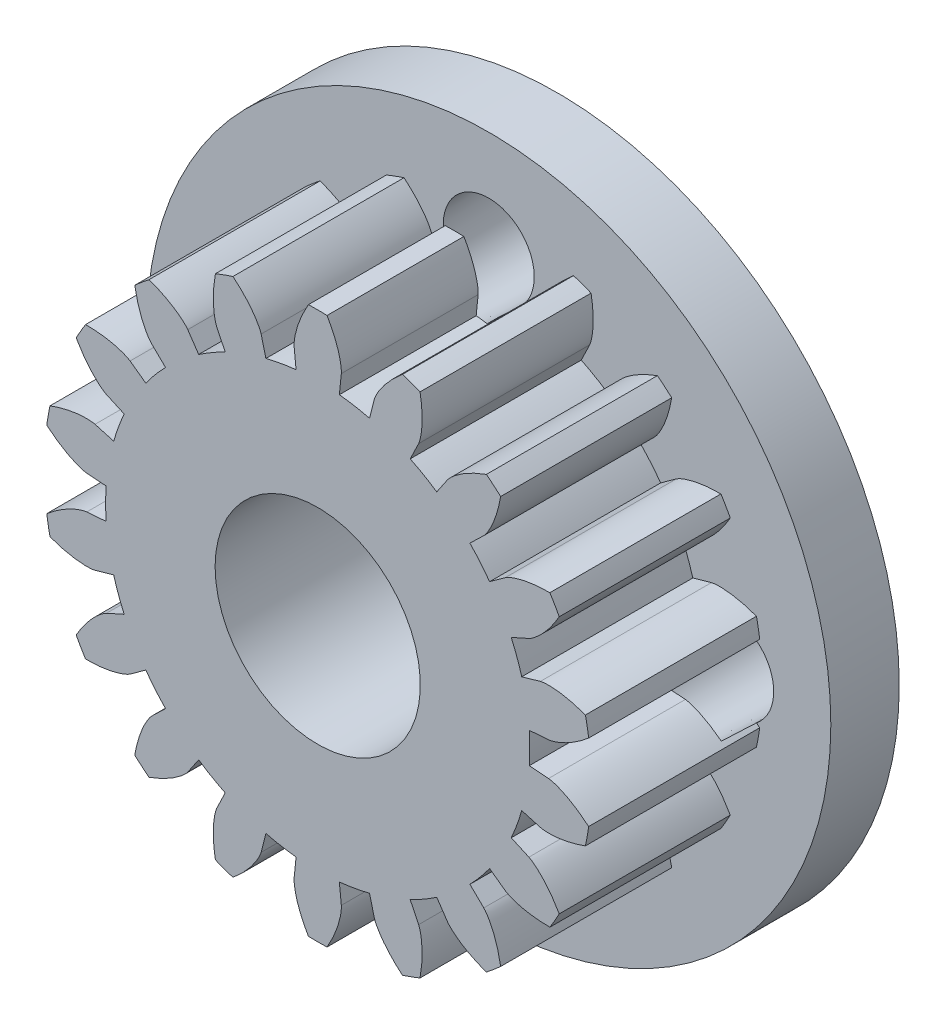
from build123d import *

# Parameters (mm, degrees)
SKETCH1_R                    = 10
BOSS_EXTRUDE1_DEPTH          = 2
BOSS_EXTRUDE3_DEPTH          = 5
SKETCH3_R                    = 3
CUT_EXTRUDE1_DEPTH           = 16.779734009
SKETCH4_R                    = 1.4
CUT_EXTRUDE2_DEPTH           = 3
CUT_EXTRUDE2_DRAFT           = -2
CUT_EXTRUDE2_PROFILE_2_DEPTH = 3
CUT_EXTRUDE2_PROFILE_2_DRAFT = -2
CUT_EXTRUDE2_PROFILE_3_DEPTH = 3
CUT_EXTRUDE2_PROFILE_3_DRAFT = -2
CUT_EXTRUDE2_PROFILE_4_DEPTH = 3
CUT_EXTRUDE2_PROFILE_4_DRAFT = -2


with BuildPart() as part:
    # Sketch1 → Boss-Extrude1 (new body)
    with BuildSketch(Plane.XY):
        Circle(SKETCH1_R)
    extrude(amount=BOSS_EXTRUDE1_DEPTH)

    # Sketch2 → Boss-Extrude3 (add)
    with BuildSketch(Plane.XY.offset(2)):
        with BuildLine():
            Line((6.749014782, 0.489400994), (6.183763142, 0.448412091))
            ThreePointArc((6.183763142, 0.448412091), (6.2, 2.2466e-05), (6.183766392, -0.448367277))
            Line((6.183766392, -0.448367277), (6.7483, -0.4893))
            add(Edge.make_bspline(
                [(6.7483, -0.4893), (6.753863752, -0.489778126), (6.764345101, -0.491112246), (6.781397959, -0.493753519), (6.814897771, -0.500152162), (6.852529813, -0.509001834), (6.894773821, -0.520587391), (6.939887939, -0.53462383), (6.978268806, -0.547605925), (7.016365203, -0.561466191), (7.054135561, -0.576092056), (7.09966227, -0.594772535), (7.153931561, -0.618509956), (7.21686143, -0.648193147), (7.287614248, -0.684137055), (7.35901509, -0.723188438), (7.428676186, -0.763596878), (7.498328383, -0.806683063), (7.565199484, -0.849970773), (7.633856787, -0.897221753), (7.696826935, -0.94200301), (7.766440753, -0.994680614), (7.822350549, -1.037926185), (7.879293096, -1.084670342), (7.906886064, -1.107725747), (7.920936065, -1.119636494)],
                knots=[0, 0, 0, 0, 0, 0.015083688, 0.02853182, 0.04661014, 0.092110526, 0.119476176, 0.146842496, 0.174208854, 0.201574956, 0.228941013, 0.256307345, 0.307035032, 0.361767352, 0.416499661, 0.471231937, 0.525964282, 0.580696616, 0.635428982, 0.690161387, 0.744893688, 0.799626082, 0.854358407, 0.909090915, 0.909090915, 0.909090915, 0.909090915, 0.909090915], degree=4))
            ThreePointArc((7.920936065, -1.119636494), (7.878103284, -1.389353333), (7.826089081, -1.657450971))
            add(Edge.make_bspline(
                [(6.509384386, -1.8484125), (6.514772707, -1.849865225), (6.525071673, -1.852195094), (6.541988666, -1.855543841), (6.575635107, -1.860986482), (6.613999847, -1.865540467), (6.657630816, -1.86910235), (6.704794877, -1.871344356), (6.745275474, -1.872274877), (6.785789161, -1.872283771), (6.826258429, -1.871462512), (6.875397666, -1.869485851), (6.934475711, -1.865749904), (7.003719504, -1.859392237), (7.082450192, -1.849830902), (7.162852052, -1.837573828), (7.242084325, -1.82344817), (7.322224026, -1.806805657), (7.399821168, -1.789023424), (7.480451083, -1.768131029), (7.554896071, -1.747613381), (7.638280252, -1.721953453), (7.705570428, -1.700464331), (7.775027063, -1.676043734), (7.808822361, -1.663830526), (7.826089081, -1.657450971)],
                knots=[0, 0, 0, 0, 0, 0.015083688, 0.02853182, 0.04661014, 0.092110526, 0.119476176, 0.146842496, 0.174208854, 0.201574956, 0.228941013, 0.256307345, 0.307035032, 0.361767352, 0.416499661, 0.471231937, 0.525964282, 0.580696616, 0.635428982, 0.690161387, 0.744893688, 0.799626082, 0.854358407, 0.909090915, 0.909090915, 0.909090915, 0.909090915, 0.909090915], degree=4))
            Line((6.509384386, -1.8484125), (5.964202561, -1.693602023))
            ThreePointArc((5.964202561, -1.693602023), (5.826101933, -2.120503778), (5.657489006, -2.536300089))
            Line((5.657489006, -2.536300089), (6.173977257, -2.767846133))
            add(Edge.make_bspline(
                [(6.173977257, -2.767846133), (6.179041945, -2.770198339), (6.188434895, -2.775036834), (6.203555971, -2.78335124), (6.232847033, -2.800821609), (6.265182819, -2.822008496), (6.300916708, -2.847343661), (6.338509366, -2.875963536), (6.370135446, -2.901289744), (6.401193859, -2.927343868), (6.431684045, -2.954005909), (6.468076057, -2.98713087), (6.510953833, -3.027997939), (6.559936318, -3.077414298), (6.614128678, -3.135389411), (6.667867163, -3.196506234), (6.719506681, -3.258303245), (6.770221993, -3.322613469), (6.818255004, -3.386161875), (6.866610979, -3.454045453), (6.91046747, -3.517663128), (6.957866259, -3.590973213), (6.995613425, -3.650733033), (7.033134474, -3.71413367), (7.051177969, -3.745236016), (7.060306936, -3.76123384)],
                knots=[0, 0, 0, 0, 0, 0.015083688, 0.02853182, 0.04661014, 0.092110526, 0.119476176, 0.146842496, 0.174208854, 0.201574956, 0.228941013, 0.256307345, 0.307035032, 0.361767352, 0.416499661, 0.471231937, 0.525964282, 0.580696616, 0.635428982, 0.690161387, 0.744893688, 0.799626082, 0.854358407, 0.909090915, 0.909090915, 0.909090915, 0.909090915, 0.909090915], degree=4))
            ThreePointArc((7.060306936, -3.76123384), (6.927808695, -4.000035089), (6.787236541, -4.234174556))
            add(Edge.make_bspline(
                [(5.484626165, -3.963280168), (5.48919267, -3.966488197), (5.498073669, -3.97220001), (5.512825104, -3.981132756), (5.542580924, -3.997754927), (5.577074432, -4.015155787), (5.616855897, -4.033425532), (5.660408805, -4.051663387), (5.698129866, -4.06638297), (5.736197238, -4.080247825), (5.774506797, -4.093317399), (5.821358633, -4.108266554), (5.878151605, -4.124961794), (5.945393936, -4.142670313), (6.022646753, -4.160613078), (6.102391953, -4.176594252), (6.181677195, -4.190419509), (6.262675955, -4.202190054), (6.341675298, -4.212020006), (6.424588255, -4.219964632), (6.501561109, -4.226146035), (6.588692821, -4.230552659), (6.659274616, -4.233374086), (6.732894839, -4.2341818), (6.768829195, -4.23426381), (6.787236541, -4.234174556)],
                knots=[0, 0, 0, 0, 0, 0.015083688, 0.02853182, 0.04661014, 0.092110526, 0.119476176, 0.146842496, 0.174208854, 0.201574956, 0.228941013, 0.256307345, 0.307035032, 0.361767352, 0.416499661, 0.471231937, 0.525964282, 0.580696616, 0.635428982, 0.690161387, 0.744893688, 0.799626082, 0.854358407, 0.909090915, 0.909090915, 0.909090915, 0.909090915, 0.909090915], degree=4))
            Line((5.484626165, -3.963280168), (5.025271128, -3.631342739))
            ThreePointArc((5.025271128, -3.631342739), (4.749489988, -3.98526597), (4.448834952, -4.318317679))
            Line((4.448834952, -4.318317679), (4.854981738, -4.712549172))
            add(Edge.make_bspline(
                [(4.854981738, -4.712549172), (4.858936486, -4.716491749), (4.866108109, -4.724251025), (4.877473578, -4.737235724), (4.899022955, -4.763670633), (4.922162312, -4.794639285), (4.947076048, -4.830668262), (4.972613017, -4.870419594), (4.993669738, -4.905035202), (5.013944064, -4.940140673), (5.033476512, -4.975623054), (5.056344414, -5.019197136), (5.082658982, -5.072264683), (5.111786071, -5.135453867), (5.142881576, -5.208467532), (5.172476049, -5.284278204), (5.1998655, -5.360010154), (5.225526913, -5.437787655), (5.248928344, -5.51393188), (5.271150546, -5.594260295), (5.29060364, -5.669041158), (5.310070407, -5.754141445), (5.325102078, -5.823207598), (5.338676036, -5.895617663), (5.344993747, -5.931015546), (5.348100592, -5.949170874)],
                knots=[0, 0, 0, 0, 0, 0.015083688, 0.02853182, 0.04661014, 0.092110526, 0.119476176, 0.146842496, 0.174208854, 0.201574956, 0.228941013, 0.256307345, 0.307035032, 0.361767352, 0.416499661, 0.471231937, 0.525964282, 0.580696616, 0.635428982, 0.690161387, 0.744893688, 0.799626082, 0.854358407, 0.909090915, 0.909090915, 0.909090915, 0.909090915, 0.909090915], degree=4))
            ThreePointArc((5.348100592, -5.949170874), (5.141918135, -6.128253579), (4.929743104, -6.3001942))
            add(Edge.make_bspline(
                [(3.798341085, -5.600117755), (3.801534984, -5.604694153), (3.807926839, -5.613098983), (3.818733474, -5.626538306), (3.841009681, -5.652335126), (3.867471532, -5.680484061), (3.89860526, -5.711258067), (3.933293892, -5.743292018), (3.963705701, -5.770025264), (3.99473527, -5.796073774), (4.026264423, -5.821457797), (4.065177835, -5.851529679), (4.112835663, -5.886642413), (4.169966116, -5.92628121), (4.23642323, -5.969563913), (4.305893323, -6.011855769), (4.375668563, -6.051964411), (4.447756737, -6.090728313), (4.518629795, -6.126984813), (4.593825267, -6.16280822), (4.664041925, -6.194943106), (4.744411798, -6.228884779), (4.809772005, -6.255676448), (4.878676131, -6.28161505), (4.91241533, -6.293982388), (4.929743104, -6.3001942)],
                knots=[0, 0, 0, 0, 0, 0.015083688, 0.02853182, 0.04661014, 0.092110526, 0.119476176, 0.146842496, 0.174208854, 0.201574956, 0.228941013, 0.256307345, 0.307035032, 0.361767352, 0.416499661, 0.471231937, 0.525964282, 0.580696616, 0.635428982, 0.690161387, 0.744893688, 0.799626082, 0.854358407, 0.909090915, 0.909090915, 0.909090915, 0.909090915, 0.909090915], degree=4))
            Line((3.798341085, -5.600117755), (3.480217833, -5.131089927))
            ThreePointArc((3.480217833, -5.131089927), (3.100019456, -5.369346271), (2.703585744, -5.579482425))
            Line((2.703585744, -5.579482425), (2.95040377, -6.088849232))
            add(Edge.make_bspline(
                [(2.95040377, -6.088849232), (2.952771577, -6.093906646), (2.95685687, -6.10365082), (2.963095889, -6.119739665), (2.974304407, -6.151950675), (2.985456387, -6.188965815), (2.996545005, -6.231342978), (3.006946151, -6.27743117), (3.014893761, -6.317161023), (3.021938617, -6.357083603), (3.028157425, -6.397106625), (3.03474301, -6.445874152), (3.041320446, -6.504741447), (3.047078983, -6.574081908), (3.051327055, -6.653327599), (3.053207986, -6.734688234), (3.053043799, -6.815220733), (3.050556167, -6.897084397), (3.04650346, -6.976640324), (3.039911563, -7.059724783), (3.032614931, -7.136649159), (3.021801696, -7.223275296), (3.012304831, -7.293317385), (3.000294477, -7.366003156), (2.994124394, -7.40142707), (2.990834386, -7.419550101)],
                knots=[0, 0, 0, 0, 0, 0.015083688, 0.02853182, 0.04661014, 0.092110526, 0.119476176, 0.146842496, 0.174208854, 0.201574956, 0.228941013, 0.256307345, 0.307035032, 0.361767352, 0.416499661, 0.471231937, 0.525964282, 0.580696616, 0.635428982, 0.690161387, 0.744893688, 0.799626082, 0.854358407, 0.909090915, 0.909090915, 0.909090915, 0.909090915, 0.909090915], degree=4))
            ThreePointArc((2.990834386, -7.419550101), (2.73583636, -7.517314244), (2.477649894, -7.606317442))
            add(Edge.make_bspline(
                [(1.653920011, -6.561498492), (1.655356075, -6.566891277), (1.658487832, -6.576975377), (1.664046229, -6.593300296), (1.676155984, -6.62516029), (1.691394487, -6.660662122), (1.710125291, -6.700228591), (1.731765687, -6.742194869), (1.751200131, -6.777717354), (1.771449272, -6.812807684), (1.792395137, -6.847444469), (1.818676594, -6.889011965), (1.851451041, -6.93830708), (1.891578839, -6.99509513), (1.939224542, -7.058497239), (1.99004041, -7.121998755), (2.041889725, -7.183553087), (2.096372414, -7.244634847), (2.15057085, -7.302944827), (2.208979153, -7.362326184), (2.263970451, -7.416538611), (2.327884692, -7.475921465), (2.380139905, -7.523451907), (2.43601708, -7.571392819), (2.463491678, -7.594553801), (2.477649894, -7.606317442)],
                knots=[0, 0, 0, 0, 0, 0.015083688, 0.02853182, 0.04661014, 0.092110526, 0.119476176, 0.146842496, 0.174208854, 0.201574956, 0.228941013, 0.256307345, 0.307035032, 0.361767352, 0.416499661, 0.471231937, 0.525964282, 0.580696616, 0.635428982, 0.690161387, 0.744893688, 0.799626082, 0.854358407, 0.909090915, 0.909090915, 0.909090915, 0.909090915, 0.909090915], degree=4))
            Line((1.653920011, -6.561498492), (1.515398904, -6.011951943))
            ThreePointArc((1.515398904, -6.011951943), (1.076640826, -6.105804168), (0.632244194, -6.167679246))
            Line((0.632244194, -6.167679246), (0.689963564, -6.730744213))
            add(Edge.make_bspline(
                [(0.689963564, -6.730744213), (0.690458837, -6.736306465), (0.690965053, -6.746860246), (0.691325104, -6.764112685), (0.690840852, -6.798214673), (0.688660362, -6.836811729), (0.68458641, -6.880425766), (0.678597201, -6.927291901), (0.672477101, -6.967343994), (0.665442774, -7.00726843), (0.657597862, -7.047004727), (0.647106811, -7.095083614), (0.633153778, -7.152650392), (0.614849199, -7.219778647), (0.591737458, -7.295698165), (0.565677979, -7.37279547), (0.537979957, -7.448415109), (0.507643325, -7.52449097), (0.476625297, -7.59786298), (0.442014381, -7.673682272), (0.408848104, -7.743471945), (0.369059103, -7.821175543), (0.336179164, -7.883745458), (0.300033125, -7.947939958), (0.282119452, -7.979117256), (0.272829414, -7.995022085)],
                knots=[0, 0, 0, 0, 0, 0.015083688, 0.02853182, 0.04661014, 0.092110526, 0.119476176, 0.146842496, 0.174208854, 0.201574956, 0.228941013, 0.256307345, 0.307035032, 0.361767352, 0.416499661, 0.471231937, 0.525964282, 0.580696616, 0.635428982, 0.690161387, 0.744893688, 0.799626082, 0.854358407, 0.909090915, 0.909090915, 0.909090915, 0.909090915, 0.909090915], degree=4))
            ThreePointArc((0.272829414, -7.995022085), (-0.000227656, -7.999675867), (-0.27328446, -7.995006544))
            add(Edge.make_bspline(
                [(-0.689988225, -6.731465673), (-0.690483207, -6.737024396), (-0.690989283, -6.747571475), (-0.691349551, -6.764812965), (-0.690866863, -6.798893346), (-0.688689695, -6.837466031), (-0.684621026, -6.881052662), (-0.678639019, -6.927889514), (-0.67252602, -6.967916703), (-0.665499652, -7.007816441), (-0.657663455, -7.04752828), (-0.647183884, -7.095577738), (-0.633245901, -7.153109514), (-0.614960762, -7.220197341), (-0.591873245, -7.296071625), (-0.565840747, -7.373123581), (-0.53817115, -7.448699243), (-0.507865361, -7.5247315), (-0.476878678, -7.598061914), (-0.442302447, -7.673838954), (-0.409169272, -7.743590102), (-0.369419664, -7.82125169), (-0.336572194, -7.883788031), (-0.300461583, -7.947948872), (-0.282565429, -7.979109942), (-0.27328446, -7.995006544)],
                knots=[0, 0, 0, 0, 0, 0.015083688, 0.02853182, 0.04661014, 0.092110526, 0.119476176, 0.146842496, 0.174208854, 0.201574956, 0.228941013, 0.256307345, 0.307035032, 0.361767352, 0.416499661, 0.471231937, 0.525964282, 0.580696616, 0.635428982, 0.690161387, 0.744893688, 0.799626082, 0.854358407, 0.909090915, 0.909090915, 0.909090915, 0.909090915, 0.909090915], degree=4))
            Line((-0.689988225, -6.731465673), (-0.632199497, -6.167683827))
            ThreePointArc((-0.632199497, -6.167683827), (-1.076596577, -6.10581197), (-1.515355336, -6.011962925))
            Line((-1.515355336, -6.011962925), (-1.653696431, -6.560812106))
            add(Edge.make_bspline(
                [(-1.653696431, -6.560812106), (-1.655133428, -6.566208307), (-1.658267347, -6.576298753), (-1.663829691, -6.592633887), (-1.675948306, -6.62451365), (-1.691198267, -6.660037247), (-1.709943409, -6.699627663), (-1.731600587, -6.741618993), (-1.751050222, -6.777162452), (-1.771315289, -6.812273269), (-1.792277708, -6.846930055), (-1.818580019, -6.88852128), (-1.851380579, -6.937844139), (-1.891540473, -6.99466353), (-1.939224409, -7.058099859), (-1.99008114, -7.121634761), (-2.041972208, -7.183220697), (-2.096498793, -7.244332883), (-2.150740911, -7.302671229), (-2.209196258, -7.362080427), (-2.264231838, -7.416317733), (-2.328197464, -7.475726591), (-2.380494672, -7.523277477), (-2.436416649, -7.571237901), (-2.46391326, -7.594408141), (-2.478082813, -7.606176412)],
                knots=[0, 0, 0, 0, 0, 0.015083688, 0.02853182, 0.04661014, 0.092110526, 0.119476176, 0.146842496, 0.174208854, 0.201574956, 0.228941013, 0.256307345, 0.307035032, 0.361767352, 0.416499661, 0.471231937, 0.525964282, 0.580696616, 0.635428982, 0.690161387, 0.744893688, 0.799626082, 0.854358407, 0.909090915, 0.909090915, 0.909090915, 0.909090915, 0.909090915], degree=4))
            ThreePointArc((-2.478082813, -7.606176412), (-2.736264213, -7.517158518), (-2.991256674, -7.419379862))
            add(Edge.make_bspline(
                [(-2.950673698, -6.089518749), (-2.953040025, -6.094572946), (-2.957122893, -6.104310869), (-2.963358371, -6.120389352), (-2.974560969, -6.152579523), (-2.985707736, -6.189570626), (-2.996791944, -6.231920228), (-3.007189843, -6.27797844), (-3.015135608, -6.317682462), (-3.022179495, -6.357579112), (-3.028398128, -6.39757617), (-3.034984435, -6.446312115), (-3.041564041, -6.505141372), (-3.04732702, -6.574437194), (-3.051582383, -6.653632095), (-3.053473158, -6.734940888), (-3.053320641, -6.815422339), (-3.050847078, -6.89723448), (-3.046809599, -6.976740599), (-3.040235844, -7.059773492), (-3.032957142, -7.136650345), (-3.022166557, -7.223223532), (-3.012688719, -7.293222967), (-3.000700145, -7.365864991), (-2.994540974, -7.401267664), (-2.991256674, -7.419379862)],
                knots=[0, 0, 0, 0, 0, 0.015083688, 0.02853182, 0.04661014, 0.092110526, 0.119476176, 0.146842496, 0.174208854, 0.201574956, 0.228941013, 0.256307345, 0.307035032, 0.361767352, 0.416499661, 0.471231937, 0.525964282, 0.580696616, 0.635428982, 0.690161387, 0.744893688, 0.799626082, 0.854358407, 0.909090915, 0.909090915, 0.909090915, 0.909090915, 0.909090915], degree=4))
            Line((-2.950673698, -6.089518749), (-2.703545309, -5.579502017))
            ThreePointArc((-2.703545309, -5.579502017), (-3.099980544, -5.369368736), (-3.480180648, -5.131115148))
            Line((-3.480180648, -5.131115148), (-3.79789623, -5.599549232))
            add(Edge.make_bspline(
                [(-3.79789623, -5.599549232), (-3.801092175, -5.60412852), (-3.807488231, -5.612538574), (-3.81830207, -5.625986146), (-3.840593364, -5.651798513), (-3.867073426, -5.679963981), (-3.898228817, -5.710755587), (-3.932941788, -5.742807339), (-3.963375045, -5.769555098), (-3.994426586, -5.795617412), (-4.025978136, -5.821014569), (-4.06491926, -5.851101616), (-4.112611115, -5.88623149), (-4.169782447, -5.92588876), (-4.236287193, -5.969190544), (-4.305807104, -6.011499796), (-4.375632388, -6.051623855), (-4.447772217, -6.090401334), (-4.518696023, -6.126669551), (-4.593945224, -6.16250303), (-4.664212004, -6.194646149), (-4.744639057, -6.228594682), (-4.810045718, -6.2553912), (-4.878998619, -6.281332814), (-4.91276167, -6.293701323), (-4.930101679, -6.299913608)],
                knots=[0, 0, 0, 0, 0, 0.015083688, 0.02853182, 0.04661014, 0.092110526, 0.119476176, 0.146842496, 0.174208854, 0.201574956, 0.228941013, 0.256307345, 0.307035032, 0.361767352, 0.416499661, 0.471231937, 0.525964282, 0.580696616, 0.635428982, 0.690161387, 0.744893688, 0.799626082, 0.854358407, 0.909090915, 0.909090915, 0.909090915, 0.909090915, 0.909090915], degree=4))
            ThreePointArc((-4.930101679, -6.299913608), (-5.142266923, -6.127960911), (-5.348439187, -5.948866471))
            add(Edge.make_bspline(
                [(-4.855464375, -4.713085991), (-4.859416632, -4.717026052), (-4.86658384, -4.724780283), (-4.877942437, -4.737756455), (-4.899479123, -4.764173807), (-4.92260536, -4.795121655), (-4.947505525, -4.831126241), (-4.97302919, -4.870850512), (-4.994075343, -4.905442477), (-5.01433989, -4.940523913), (-5.033863292, -4.975981957), (-5.056721072, -5.019526115), (-5.08302467, -5.072557175), (-5.112140665, -5.135702893), (-5.14322565, -5.208666337), (-5.172811642, -5.284424926), (-5.200194601, -5.360104917), (-5.225851612, -5.43782919), (-5.249250317, -5.513921402), (-5.27147193, -5.594195155), (-5.29092562, -5.668925229), (-5.31039556, -5.753968013), (-5.325430523, -5.822987576), (-5.339009983, -5.895349085), (-5.345330683, -5.930723275), (-5.348439187, -5.948866471)],
                knots=[0, 0, 0, 0, 0, 0.015083688, 0.02853182, 0.04661014, 0.092110526, 0.119476176, 0.146842496, 0.174208854, 0.201574956, 0.228941013, 0.256307345, 0.307035032, 0.361767352, 0.416499661, 0.471231937, 0.525964282, 0.580696616, 0.635428982, 0.690161387, 0.744893688, 0.799626082, 0.854358407, 0.909090915, 0.909090915, 0.909090915, 0.909090915, 0.909090915], degree=4))
            Line((-4.855464375, -4.713085991), (-4.448803657, -4.318349919))
            ThreePointArc((-4.448803657, -4.318349919), (-4.749461107, -3.98530039), (-5.025244812, -3.631379157))
            Line((-5.025244812, -3.631379157), (-5.484013693, -3.96289808))
            add(Edge.make_bspline(
                [(-5.484013693, -3.96289808), (-5.488583108, -3.966108126), (-5.497469842, -3.971823412), (-5.512230867, -3.980761445), (-5.542006181, -3.997393064), (-5.576522457, -4.014803232), (-5.616330297, -4.033082106), (-5.659912165, -4.051328365), (-5.697658345, -4.06605425), (-5.735751085, -4.079924562), (-5.774086183, -4.092998817), (-5.820969246, -4.107952744), (-5.877800055, -4.124652453), (-5.945087119, -4.142364349), (-6.02239122, -4.160308754), (-6.102189184, -4.176289235), (-6.181526724, -4.190111864), (-6.262578668, -4.201877501), (-6.341629707, -4.211701106), (-6.424596597, -4.219636819), (-6.501619366, -4.225808817), (-6.588807156, -4.23020233), (-6.659434262, -4.233012425), (-6.733101348, -4.233806287), (-6.769058517, -4.23388124), (-6.787477523, -4.233788246)],
                knots=[0, 0, 0, 0, 0, 0.015083688, 0.02853182, 0.04661014, 0.092110526, 0.119476176, 0.146842496, 0.174208854, 0.201574956, 0.228941013, 0.256307345, 0.307035032, 0.361767352, 0.416499661, 0.471231937, 0.525964282, 0.580696616, 0.635428982, 0.690161387, 0.744893688, 0.799626082, 0.854358407, 0.909090915, 0.909090915, 0.909090915, 0.909090915, 0.909090915], degree=4))
            ThreePointArc((-6.787477523, -4.233788246), (-6.928036351, -3.999640778), (-7.060521, -3.760831987))
            add(Edge.make_bspline(
                [(-6.17461439, -2.768185506), (-6.179675877, -2.7705362), (-6.189062953, -2.775371464), (-6.204174655, -2.783680209), (-6.233447786, -2.801138419), (-6.265764128, -2.822310244), (-6.301476923, -2.84762713), (-6.339047823, -2.876226127), (-6.370655886, -2.901533733), (-6.401696889, -2.927568616), (-6.432170252, -2.954210881), (-6.468542518, -2.987311184), (-6.511397506, -3.02814772), (-6.560354699, -3.077527028), (-6.614519997, -3.135458547), (-6.6682327, -3.196529329), (-6.719848345, -3.258279734), (-6.770541316, -3.322541446), (-6.818553976, -3.386041908), (-6.866890702, -3.453874322), (-6.910730381, -3.517444067), (-6.958112485, -3.590699031), (-6.99584681, -3.650413945), (-7.033356422, -3.713767072), (-7.051394623, -3.744846131), (-7.060521, -3.760831987)],
                knots=[0, 0, 0, 0, 0, 0.015083688, 0.02853182, 0.04661014, 0.092110526, 0.119476176, 0.146842496, 0.174208854, 0.201574956, 0.228941013, 0.256307345, 0.307035032, 0.361767352, 0.416499661, 0.471231937, 0.525964282, 0.580696616, 0.635428982, 0.690161387, 0.744893688, 0.799626082, 0.854358407, 0.909090915, 0.909090915, 0.909090915, 0.909090915, 0.909090915], degree=4))
            Line((-6.17461439, -2.768185506), (-5.657470626, -2.536341089))
            ThreePointArc((-5.657470626, -2.536341089), (-5.826086565, -2.120545999), (-5.964190287, -1.693645246))
            Line((-5.964190287, -1.693645246), (-6.508678169, -1.848262934))
            add(Edge.make_bspline(
                [(-6.508678169, -1.848262934), (-6.514069915, -1.849716558), (-6.524375456, -1.852047728), (-6.54130327, -1.855398163), (-6.574971262, -1.860843016), (-6.613360579, -1.865397961), (-6.657019456, -1.8689594), (-6.704213604, -1.871199399), (-6.74471996, -1.872127251), (-6.785259353, -1.872132596), (-6.82575422, -1.871307002), (-6.874924433, -1.869324145), (-6.934039561, -1.865579456), (-7.003326544, -1.859209663), (-7.082105985, -1.849632328), (-7.16255719, -1.837356557), (-7.241837708, -1.823210543), (-7.322025707, -1.806545227), (-7.399669255, -1.788739349), (-7.480346804, -1.767820132), (-7.554835479, -1.747276574), (-7.638267872, -1.721585146), (-7.705596751, -1.700069879), (-7.775092685, -1.675620238), (-7.808907007, -1.663392594), (-7.826183404, -1.657005537)],
                knots=[0, 0, 0, 0, 0, 0.015083688, 0.02853182, 0.04661014, 0.092110526, 0.119476176, 0.146842496, 0.174208854, 0.201574956, 0.228941013, 0.256307345, 0.307035032, 0.361767352, 0.416499661, 0.471231937, 0.525964282, 0.580696616, 0.635428982, 0.690161387, 0.744893688, 0.799626082, 0.854358407, 0.909090915, 0.909090915, 0.909090915, 0.909090915, 0.909090915], degree=4))
            ThreePointArc((-7.826183404, -1.657005537), (-7.878182348, -1.388904939), (-7.920999778, -1.119185662))
            add(Edge.make_bspline(
                [(-6.749014782, -0.489400994), (-6.754575009, -0.489878793), (-6.765049732, -0.491211887), (-6.782091845, -0.493851046), (-6.81557065, -0.500244397), (-6.853179268, -0.509086565), (-6.895397204, -0.520662161), (-6.940483735, -0.534686422), (-6.978841309, -0.547657199), (-7.016914765, -0.561505338), (-7.05466255, -0.576118374), (-7.10016227, -0.594782437), (-7.154399704, -0.618498959), (-7.217293135, -0.648155984), (-7.288005613, -0.684068182), (-7.359366481, -0.723085119), (-7.428989204, -0.763457929), (-7.498603815, -0.806506168), (-7.565439394, -0.849755786), (-7.634061111, -0.896965271), (-7.696999068, -0.941707238), (-7.766578355, -0.994338754), (-7.822460724, -1.037546519), (-7.879376276, -1.084249941), (-7.906956304, -1.107285276), (-7.920999778, -1.119185662)],
                knots=[0, 0, 0, 0, 0, 0.015083688, 0.02853182, 0.04661014, 0.092110526, 0.119476176, 0.146842496, 0.174208854, 0.201574956, 0.228941013, 0.256307345, 0.307035032, 0.361767352, 0.416499661, 0.471231937, 0.525964282, 0.580696616, 0.635428982, 0.690161387, 0.744893688, 0.799626082, 0.854358407, 0.909090915, 0.909090915, 0.909090915, 0.909090915, 0.909090915], degree=4))
            Line((-6.749014782, -0.489400994), (-6.183763142, -0.448412091))
            ThreePointArc((-6.183763142, -0.448412091), (-6.2, -2.2466e-05), (-6.183766392, 0.448367277))
            Line((-6.183766392, 0.448367277), (-6.7483, 0.4893))
            add(Edge.make_bspline(
                [(-6.7483, 0.4893), (-6.753863752, 0.489778126), (-6.764345101, 0.491112246), (-6.781397959, 0.493753519), (-6.814897771, 0.500152162), (-6.852529813, 0.509001834), (-6.894773822, 0.520587391), (-6.939887939, 0.53462383), (-6.978268806, 0.547605925), (-7.016365203, 0.561466191), (-7.054135561, 0.576092056), (-7.09966227, 0.594772535), (-7.153931561, 0.618509956), (-7.21686143, 0.648193148), (-7.287614248, 0.684137055), (-7.35901509, 0.723188438), (-7.428676186, 0.763596878), (-7.498328383, 0.806683063), (-7.565199484, 0.849970773), (-7.633856787, 0.897221753), (-7.696826935, 0.94200301), (-7.766440753, 0.994680614), (-7.822350549, 1.037926185), (-7.879293096, 1.084670342), (-7.906886064, 1.107725747), (-7.920936065, 1.119636494)],
                knots=[0, 0, 0, 0, 0, 0.015083688, 0.02853182, 0.04661014, 0.092110526, 0.119476176, 0.146842496, 0.174208854, 0.201574956, 0.228941013, 0.256307345, 0.307035032, 0.361767352, 0.416499661, 0.471231937, 0.525964282, 0.580696616, 0.635428982, 0.690161387, 0.744893688, 0.799626082, 0.854358407, 0.909090915, 0.909090915, 0.909090915, 0.909090915, 0.909090915], degree=4))
            ThreePointArc((-7.920936065, 1.119636494), (-7.878103284, 1.389353333), (-7.826089081, 1.657450971))
            add(Edge.make_bspline(
                [(-6.509384386, 1.8484125), (-6.514772707, 1.849865225), (-6.525071673, 1.852195094), (-6.541988666, 1.855543841), (-6.575635107, 1.860986482), (-6.613999847, 1.865540467), (-6.657630816, 1.86910235), (-6.704794877, 1.871344356), (-6.745275474, 1.872274877), (-6.785789161, 1.872283771), (-6.826258429, 1.871462512), (-6.875397666, 1.869485851), (-6.934475711, 1.865749904), (-7.003719504, 1.859392237), (-7.082450192, 1.849830902), (-7.162852052, 1.837573828), (-7.242084325, 1.82344817), (-7.322224026, 1.806805657), (-7.399821168, 1.789023424), (-7.480451083, 1.768131029), (-7.554896071, 1.747613381), (-7.638280252, 1.721953453), (-7.705570428, 1.700464331), (-7.775027063, 1.676043734), (-7.808822361, 1.663830526), (-7.826089081, 1.657450971)],
                knots=[0, 0, 0, 0, 0, 0.015083688, 0.02853182, 0.04661014, 0.092110526, 0.119476176, 0.146842496, 0.174208854, 0.201574956, 0.228941013, 0.256307345, 0.307035032, 0.361767352, 0.416499661, 0.471231937, 0.525964282, 0.580696616, 0.635428982, 0.690161387, 0.744893688, 0.799626082, 0.854358407, 0.909090915, 0.909090915, 0.909090915, 0.909090915, 0.909090915], degree=4))
            Line((-6.509384386, 1.8484125), (-5.964202561, 1.693602023))
            ThreePointArc((-5.964202561, 1.693602023), (-5.826101933, 2.120503778), (-5.657489006, 2.536300089))
            Line((-5.657489006, 2.536300089), (-6.173977257, 2.767846133))
            add(Edge.make_bspline(
                [(-6.173977257, 2.767846133), (-6.179041945, 2.770198339), (-6.188434895, 2.775036834), (-6.203555971, 2.78335124), (-6.232847033, 2.800821609), (-6.265182819, 2.822008496), (-6.300916708, 2.847343661), (-6.338509366, 2.875963536), (-6.370135446, 2.901289744), (-6.401193859, 2.927343869), (-6.431684045, 2.954005909), (-6.468076058, 2.98713087), (-6.510953833, 3.02799794), (-6.559936318, 3.077414298), (-6.614128678, 3.135389411), (-6.667867164, 3.196506234), (-6.719506681, 3.258303245), (-6.770221993, 3.32261347), (-6.818255004, 3.386161875), (-6.866610979, 3.454045453), (-6.91046747, 3.517663128), (-6.957866259, 3.590973213), (-6.995613425, 3.650733033), (-7.033134474, 3.71413367), (-7.051177969, 3.745236016), (-7.060306936, 3.76123384)],
                knots=[0, 0, 0, 0, 0, 0.015083688, 0.02853182, 0.04661014, 0.092110526, 0.119476176, 0.146842496, 0.174208854, 0.201574956, 0.228941013, 0.256307345, 0.307035032, 0.361767352, 0.416499661, 0.471231937, 0.525964282, 0.580696616, 0.635428982, 0.690161387, 0.744893688, 0.799626082, 0.854358407, 0.909090915, 0.909090915, 0.909090915, 0.909090915, 0.909090915], degree=4))
            ThreePointArc((-7.060306936, 3.76123384), (-6.927808695, 4.000035089), (-6.787236541, 4.234174556))
            add(Edge.make_bspline(
                [(-5.484626165, 3.963280168), (-5.48919267, 3.966488197), (-5.498073669, 3.97220001), (-5.512825104, 3.981132756), (-5.542580924, 3.997754927), (-5.577074432, 4.015155787), (-5.616855897, 4.033425532), (-5.660408805, 4.051663387), (-5.698129866, 4.06638297), (-5.736197238, 4.080247825), (-5.774506797, 4.093317399), (-5.821358633, 4.108266554), (-5.878151605, 4.124961794), (-5.945393936, 4.142670313), (-6.022646753, 4.160613078), (-6.102391953, 4.176594252), (-6.181677195, 4.190419509), (-6.262675955, 4.202190054), (-6.341675298, 4.212020006), (-6.424588255, 4.219964632), (-6.501561109, 4.226146035), (-6.588692821, 4.230552659), (-6.659274616, 4.233374086), (-6.732894839, 4.2341818), (-6.768829195, 4.23426381), (-6.787236541, 4.234174556)],
                knots=[0, 0, 0, 0, 0, 0.015083688, 0.02853182, 0.04661014, 0.092110526, 0.119476176, 0.146842496, 0.174208854, 0.201574956, 0.228941013, 0.256307345, 0.307035032, 0.361767352, 0.416499661, 0.471231937, 0.525964282, 0.580696616, 0.635428982, 0.690161387, 0.744893688, 0.799626082, 0.854358407, 0.909090915, 0.909090915, 0.909090915, 0.909090915, 0.909090915], degree=4))
            Line((-5.484626165, 3.963280168), (-5.025271128, 3.631342739))
            ThreePointArc((-5.025271128, 3.631342739), (-4.749489988, 3.98526597), (-4.448834952, 4.318317679))
            Line((-4.448834952, 4.318317679), (-4.854981738, 4.712549172))
            add(Edge.make_bspline(
                [(-4.854981738, 4.712549172), (-4.858936486, 4.716491749), (-4.866108109, 4.724251025), (-4.877473579, 4.737235724), (-4.899022955, 4.763670633), (-4.922162312, 4.794639286), (-4.947076048, 4.830668262), (-4.972613017, 4.870419594), (-4.993669738, 4.905035202), (-5.013944064, 4.940140673), (-5.033476512, 4.975623054), (-5.056344414, 5.019197136), (-5.082658982, 5.072264683), (-5.111786071, 5.135453867), (-5.142881576, 5.208467532), (-5.172476049, 5.284278204), (-5.1998655, 5.360010154), (-5.225526913, 5.437787656), (-5.248928344, 5.51393188), (-5.271150546, 5.594260295), (-5.29060364, 5.669041159), (-5.310070407, 5.754141445), (-5.325102078, 5.823207598), (-5.338676036, 5.895617663), (-5.344993747, 5.931015547), (-5.348100592, 5.949170874)],
                knots=[0, 0, 0, 0, 0, 0.015083688, 0.02853182, 0.04661014, 0.092110526, 0.119476176, 0.146842496, 0.174208854, 0.201574956, 0.228941013, 0.256307345, 0.307035032, 0.361767352, 0.416499661, 0.471231937, 0.525964282, 0.580696616, 0.635428982, 0.690161387, 0.744893688, 0.799626082, 0.854358407, 0.909090915, 0.909090915, 0.909090915, 0.909090915, 0.909090915], degree=4))
            ThreePointArc((-5.348100592, 5.949170874), (-5.141918135, 6.128253579), (-4.929743104, 6.3001942))
            add(Edge.make_bspline(
                [(-3.798341085, 5.600117755), (-3.801534984, 5.604694153), (-3.807926839, 5.613098983), (-3.818733474, 5.626538305), (-3.841009681, 5.652335126), (-3.867471532, 5.680484061), (-3.89860526, 5.711258067), (-3.933293892, 5.743292018), (-3.963705701, 5.770025264), (-3.99473527, 5.796073774), (-4.026264422, 5.821457797), (-4.065177835, 5.851529679), (-4.112835663, 5.886642413), (-4.169966115, 5.92628121), (-4.23642323, 5.969563913), (-4.305893323, 6.011855769), (-4.375668563, 6.051964411), (-4.447756737, 6.090728313), (-4.518629795, 6.126984813), (-4.593825267, 6.16280822), (-4.664041925, 6.194943106), (-4.744411798, 6.228884779), (-4.809772005, 6.255676448), (-4.878676131, 6.28161505), (-4.91241533, 6.293982388), (-4.929743104, 6.3001942)],
                knots=[0, 0, 0, 0, 0, 0.015083688, 0.02853182, 0.04661014, 0.092110526, 0.119476176, 0.146842496, 0.174208854, 0.201574956, 0.228941013, 0.256307345, 0.307035032, 0.361767352, 0.416499661, 0.471231937, 0.525964282, 0.580696616, 0.635428982, 0.690161387, 0.744893688, 0.799626082, 0.854358407, 0.909090915, 0.909090915, 0.909090915, 0.909090915, 0.909090915], degree=4))
            Line((-3.798341085, 5.600117755), (-3.480217833, 5.131089927))
            ThreePointArc((-3.480217833, 5.131089927), (-3.100019456, 5.369346271), (-2.703585744, 5.579482425))
            Line((-2.703585744, 5.579482425), (-2.95040377, 6.088849232))
            add(Edge.make_bspline(
                [(-2.95040377, 6.088849232), (-2.952771577, 6.093906646), (-2.95685687, 6.10365082), (-2.963095889, 6.119739665), (-2.974304407, 6.151950675), (-2.985456387, 6.188965815), (-2.996545005, 6.231342979), (-3.006946151, 6.27743117), (-3.014893761, 6.317161023), (-3.021938617, 6.357083603), (-3.028157425, 6.397106625), (-3.03474301, 6.445874152), (-3.041320446, 6.504741447), (-3.047078983, 6.574081908), (-3.051327055, 6.653327599), (-3.053207986, 6.734688234), (-3.053043799, 6.815220733), (-3.050556167, 6.897084397), (-3.04650346, 6.976640324), (-3.039911563, 7.059724783), (-3.032614931, 7.136649159), (-3.021801696, 7.223275296), (-3.012304831, 7.293317385), (-3.000294477, 7.366003156), (-2.994124394, 7.40142707), (-2.990834386, 7.419550101)],
                knots=[0, 0, 0, 0, 0, 0.015083688, 0.02853182, 0.04661014, 0.092110526, 0.119476176, 0.146842496, 0.174208854, 0.201574956, 0.228941013, 0.256307345, 0.307035032, 0.361767352, 0.416499661, 0.471231937, 0.525964282, 0.580696616, 0.635428982, 0.690161387, 0.744893688, 0.799626082, 0.854358407, 0.909090915, 0.909090915, 0.909090915, 0.909090915, 0.909090915], degree=4))
            ThreePointArc((-2.990834386, 7.419550101), (-2.73583636, 7.517314244), (-2.477649894, 7.606317442))
            add(Edge.make_bspline(
                [(-1.653920011, 6.561498492), (-1.655356075, 6.566891277), (-1.658487832, 6.576975377), (-1.664046229, 6.593300296), (-1.676155984, 6.62516029), (-1.691394487, 6.660662122), (-1.710125291, 6.700228591), (-1.731765687, 6.742194869), (-1.751200131, 6.777717354), (-1.771449272, 6.812807684), (-1.792395137, 6.847444469), (-1.818676594, 6.889011965), (-1.851451041, 6.93830708), (-1.891578839, 6.99509513), (-1.939224542, 7.058497239), (-1.99004041, 7.121998755), (-2.041889725, 7.183553087), (-2.096372414, 7.244634847), (-2.15057085, 7.302944827), (-2.208979153, 7.362326184), (-2.263970451, 7.416538611), (-2.327884692, 7.475921465), (-2.380139905, 7.523451907), (-2.43601708, 7.571392819), (-2.463491678, 7.594553801), (-2.477649894, 7.606317442)],
                knots=[0, 0, 0, 0, 0, 0.015083688, 0.02853182, 0.04661014, 0.092110526, 0.119476176, 0.146842496, 0.174208854, 0.201574956, 0.228941013, 0.256307345, 0.307035032, 0.361767352, 0.416499661, 0.471231937, 0.525964282, 0.580696616, 0.635428982, 0.690161387, 0.744893688, 0.799626082, 0.854358407, 0.909090915, 0.909090915, 0.909090915, 0.909090915, 0.909090915], degree=4))
            Line((-1.653920011, 6.561498492), (-1.515398904, 6.011951943))
            ThreePointArc((-1.515398904, 6.011951943), (-1.076640826, 6.105804168), (-0.632244194, 6.167679246))
            Line((-0.632244194, 6.167679246), (-0.689963564, 6.730744213))
            add(Edge.make_bspline(
                [(-0.689963564, 6.730744213), (-0.690458837, 6.736306465), (-0.690965053, 6.746860246), (-0.691325104, 6.764112685), (-0.690840852, 6.798214673), (-0.688660362, 6.836811729), (-0.68458641, 6.880425767), (-0.678597201, 6.927291901), (-0.672477101, 6.967343994), (-0.665442774, 7.007268431), (-0.657597862, 7.047004727), (-0.647106811, 7.095083614), (-0.633153778, 7.152650392), (-0.614849199, 7.219778647), (-0.591737458, 7.295698165), (-0.565677979, 7.37279547), (-0.537979957, 7.448415109), (-0.507643325, 7.52449097), (-0.476625297, 7.59786298), (-0.442014381, 7.673682272), (-0.408848104, 7.743471945), (-0.369059103, 7.821175543), (-0.336179163, 7.883745458), (-0.300033125, 7.947939958), (-0.282119452, 7.979117256), (-0.272829414, 7.995022085)],
                knots=[0, 0, 0, 0, 0, 0.015083688, 0.02853182, 0.04661014, 0.092110526, 0.119476176, 0.146842496, 0.174208854, 0.201574956, 0.228941013, 0.256307345, 0.307035032, 0.361767352, 0.416499661, 0.471231937, 0.525964282, 0.580696616, 0.635428982, 0.690161387, 0.744893688, 0.799626082, 0.854358407, 0.909090915, 0.909090915, 0.909090915, 0.909090915, 0.909090915], degree=4))
            ThreePointArc((-0.272829414, 7.995022085), (0.000227656, 7.999675867), (0.27328446, 7.995006544))
            add(Edge.make_bspline(
                [(0.689988225, 6.731465673), (0.690483207, 6.737024396), (0.690989283, 6.747571475), (0.691349551, 6.764812965), (0.690866863, 6.798893346), (0.688689695, 6.837466031), (0.684621026, 6.881052662), (0.678639019, 6.927889514), (0.67252602, 6.967916703), (0.665499652, 7.007816441), (0.657663455, 7.04752828), (0.647183884, 7.095577738), (0.633245901, 7.153109514), (0.614960762, 7.220197341), (0.591873245, 7.296071625), (0.565840747, 7.373123581), (0.53817115, 7.448699243), (0.507865361, 7.5247315), (0.476878678, 7.598061914), (0.442302447, 7.673838954), (0.409169272, 7.743590102), (0.369419664, 7.82125169), (0.336572194, 7.883788031), (0.300461583, 7.947948872), (0.282565429, 7.979109942), (0.27328446, 7.995006544)],
                knots=[0, 0, 0, 0, 0, 0.015083688, 0.02853182, 0.04661014, 0.092110526, 0.119476176, 0.146842496, 0.174208854, 0.201574956, 0.228941013, 0.256307345, 0.307035032, 0.361767352, 0.416499661, 0.471231937, 0.525964282, 0.580696616, 0.635428982, 0.690161387, 0.744893688, 0.799626082, 0.854358407, 0.909090915, 0.909090915, 0.909090915, 0.909090915, 0.909090915], degree=4))
            Line((0.689988225, 6.731465673), (0.632199497, 6.167683827))
            ThreePointArc((0.632199497, 6.167683827), (1.076596577, 6.10581197), (1.515355336, 6.011962925))
            Line((1.515355336, 6.011962925), (1.653696431, 6.560812106))
            add(Edge.make_bspline(
                [(1.653696431, 6.560812106), (1.655133429, 6.566208307), (1.658267347, 6.576298753), (1.663829691, 6.592633887), (1.675948306, 6.62451365), (1.691198267, 6.660037247), (1.709943409, 6.699627663), (1.731600587, 6.741618993), (1.751050222, 6.777162452), (1.771315289, 6.812273269), (1.792277708, 6.846930055), (1.818580019, 6.888521281), (1.851380579, 6.937844139), (1.891540473, 6.99466353), (1.939224409, 7.058099859), (1.99008114, 7.121634761), (2.041972208, 7.183220697), (2.096498794, 7.244332883), (2.150740911, 7.302671229), (2.209196258, 7.362080427), (2.264231838, 7.416317733), (2.328197465, 7.475726591), (2.380494672, 7.523277477), (2.436416649, 7.571237901), (2.46391326, 7.594408141), (2.478082813, 7.606176412)],
                knots=[0, 0, 0, 0, 0, 0.015083688, 0.02853182, 0.04661014, 0.092110526, 0.119476176, 0.146842496, 0.174208854, 0.201574956, 0.228941013, 0.256307345, 0.307035032, 0.361767352, 0.416499661, 0.471231937, 0.525964282, 0.580696616, 0.635428982, 0.690161387, 0.744893688, 0.799626082, 0.854358407, 0.909090915, 0.909090915, 0.909090915, 0.909090915, 0.909090915], degree=4))
            ThreePointArc((2.478082813, 7.606176412), (2.736264213, 7.517158518), (2.991256674, 7.419379862))
            add(Edge.make_bspline(
                [(2.950673698, 6.089518749), (2.953040025, 6.094572946), (2.957122893, 6.104310869), (2.963358371, 6.120389352), (2.974560969, 6.152579523), (2.985707736, 6.189570626), (2.996791944, 6.231920228), (3.007189843, 6.27797844), (3.015135608, 6.317682462), (3.022179495, 6.357579112), (3.028398128, 6.39757617), (3.034984435, 6.446312115), (3.041564041, 6.505141372), (3.04732702, 6.574437194), (3.051582383, 6.653632095), (3.053473158, 6.734940888), (3.053320641, 6.815422339), (3.050847078, 6.89723448), (3.046809599, 6.976740599), (3.040235844, 7.059773492), (3.032957142, 7.136650345), (3.022166557, 7.223223532), (3.012688719, 7.293222967), (3.000700145, 7.365864991), (2.994540974, 7.401267664), (2.991256674, 7.419379862)],
                knots=[0, 0, 0, 0, 0, 0.015083688, 0.02853182, 0.04661014, 0.092110526, 0.119476176, 0.146842496, 0.174208854, 0.201574956, 0.228941013, 0.256307345, 0.307035032, 0.361767352, 0.416499661, 0.471231937, 0.525964282, 0.580696616, 0.635428982, 0.690161387, 0.744893688, 0.799626082, 0.854358407, 0.909090915, 0.909090915, 0.909090915, 0.909090915, 0.909090915], degree=4))
            Line((2.950673698, 6.089518749), (2.703545309, 5.579502017))
            ThreePointArc((2.703545309, 5.579502017), (3.099980544, 5.369368736), (3.480180648, 5.131115148))
            Line((3.480180648, 5.131115148), (3.79789623, 5.599549232))
            add(Edge.make_bspline(
                [(3.79789623, 5.599549232), (3.801092175, 5.60412852), (3.807488231, 5.612538574), (3.81830207, 5.625986146), (3.840593364, 5.651798513), (3.867073426, 5.679963981), (3.898228817, 5.710755587), (3.932941788, 5.742807339), (3.963375045, 5.769555098), (3.994426586, 5.795617412), (4.025978136, 5.821014569), (4.06491926, 5.851101616), (4.112611115, 5.88623149), (4.169782447, 5.92588876), (4.236287193, 5.969190544), (4.305807104, 6.011499796), (4.375632388, 6.051623855), (4.447772217, 6.090401334), (4.518696023, 6.126669551), (4.593945224, 6.16250303), (4.664212004, 6.194646149), (4.744639057, 6.228594682), (4.810045718, 6.2553912), (4.878998619, 6.281332814), (4.91276167, 6.293701323), (4.930101679, 6.299913608)],
                knots=[0, 0, 0, 0, 0, 0.015083688, 0.02853182, 0.04661014, 0.092110526, 0.119476176, 0.146842496, 0.174208854, 0.201574956, 0.228941013, 0.256307345, 0.307035032, 0.361767352, 0.416499661, 0.471231937, 0.525964282, 0.580696616, 0.635428982, 0.690161387, 0.744893688, 0.799626082, 0.854358407, 0.909090915, 0.909090915, 0.909090915, 0.909090915, 0.909090915], degree=4))
            ThreePointArc((4.930101679, 6.299913608), (5.142266923, 6.127960911), (5.348439187, 5.948866471))
            add(Edge.make_bspline(
                [(4.855464375, 4.713085991), (4.859416632, 4.717026052), (4.86658384, 4.724780283), (4.877942437, 4.737756455), (4.899479123, 4.764173807), (4.92260536, 4.795121655), (4.947505525, 4.831126241), (4.97302919, 4.870850512), (4.994075343, 4.905442477), (5.01433989, 4.940523913), (5.033863292, 4.975981957), (5.056721072, 5.019526115), (5.08302467, 5.072557175), (5.112140665, 5.135702893), (5.14322565, 5.208666337), (5.172811642, 5.284424926), (5.200194601, 5.360104917), (5.225851612, 5.43782919), (5.249250317, 5.513921402), (5.27147193, 5.594195155), (5.29092562, 5.668925229), (5.31039556, 5.753968013), (5.325430523, 5.822987576), (5.339009983, 5.895349085), (5.345330683, 5.930723275), (5.348439187, 5.948866471)],
                knots=[0, 0, 0, 0, 0, 0.015083688, 0.02853182, 0.04661014, 0.092110526, 0.119476176, 0.146842496, 0.174208854, 0.201574956, 0.228941013, 0.256307345, 0.307035032, 0.361767352, 0.416499661, 0.471231937, 0.525964282, 0.580696616, 0.635428982, 0.690161387, 0.744893688, 0.799626082, 0.854358407, 0.909090915, 0.909090915, 0.909090915, 0.909090915, 0.909090915], degree=4))
            Line((4.855464375, 4.713085991), (4.448803657, 4.318349919))
            ThreePointArc((4.448803657, 4.318349919), (4.749461107, 3.98530039), (5.025244812, 3.631379157))
            Line((5.025244812, 3.631379157), (5.484013693, 3.96289808))
            add(Edge.make_bspline(
                [(5.484013693, 3.96289808), (5.488583108, 3.966108126), (5.497469843, 3.971823412), (5.512230867, 3.980761445), (5.542006181, 3.997393064), (5.576522457, 4.014803232), (5.616330298, 4.033082106), (5.659912166, 4.051328365), (5.697658345, 4.06605425), (5.735751085, 4.079924562), (5.774086183, 4.092998817), (5.820969247, 4.107952745), (5.877800055, 4.124652453), (5.945087119, 4.142364349), (6.02239122, 4.160308754), (6.102189184, 4.176289235), (6.181526724, 4.190111864), (6.262578668, 4.201877501), (6.341629707, 4.211701106), (6.424596598, 4.219636819), (6.501619366, 4.225808817), (6.588807156, 4.23020233), (6.659434262, 4.233012425), (6.733101348, 4.233806287), (6.769058517, 4.23388124), (6.787477523, 4.233788246)],
                knots=[0, 0, 0, 0, 0, 0.015083688, 0.02853182, 0.04661014, 0.092110526, 0.119476176, 0.146842496, 0.174208854, 0.201574956, 0.228941013, 0.256307345, 0.307035032, 0.361767352, 0.416499661, 0.471231937, 0.525964282, 0.580696616, 0.635428982, 0.690161387, 0.744893688, 0.799626082, 0.854358407, 0.909090915, 0.909090915, 0.909090915, 0.909090915, 0.909090915], degree=4))
            ThreePointArc((6.787477523, 4.233788246), (6.928036351, 3.999640778), (7.060521, 3.760831987))
            add(Edge.make_bspline(
                [(6.17461439, 2.768185506), (6.179675877, 2.7705362), (6.189062953, 2.775371464), (6.204174655, 2.783680209), (6.233447786, 2.801138419), (6.265764127, 2.822310244), (6.301476923, 2.84762713), (6.339047823, 2.876226127), (6.370655886, 2.901533733), (6.401696889, 2.927568616), (6.432170252, 2.954210881), (6.468542518, 2.987311184), (6.511397506, 3.02814772), (6.560354698, 3.077527028), (6.614519997, 3.135458547), (6.6682327, 3.196529329), (6.719848345, 3.258279734), (6.770541316, 3.322541446), (6.818553976, 3.386041908), (6.866890702, 3.453874322), (6.910730381, 3.517444067), (6.958112485, 3.590699031), (6.99584681, 3.650413945), (7.033356422, 3.713767072), (7.051394623, 3.744846131), (7.060521, 3.760831987)],
                knots=[0, 0, 0, 0, 0, 0.015083688, 0.02853182, 0.04661014, 0.092110526, 0.119476176, 0.146842496, 0.174208854, 0.201574956, 0.228941013, 0.256307345, 0.307035032, 0.361767352, 0.416499661, 0.471231937, 0.525964282, 0.580696616, 0.635428982, 0.690161387, 0.744893688, 0.799626082, 0.854358407, 0.909090915, 0.909090915, 0.909090915, 0.909090915, 0.909090915], degree=4))
            Line((6.17461439, 2.768185506), (5.657470626, 2.536341089))
            ThreePointArc((5.657470626, 2.536341089), (5.826086565, 2.120545999), (5.964190287, 1.693645246))
            Line((5.964190287, 1.693645246), (6.508678169, 1.848262934))
            add(Edge.make_bspline(
                [(6.508678169, 1.848262934), (6.514069915, 1.849716558), (6.524375457, 1.852047728), (6.54130327, 1.855398163), (6.574971262, 1.860843016), (6.613360579, 1.865397961), (6.657019456, 1.8689594), (6.704213605, 1.871199399), (6.74471996, 1.872127251), (6.785259353, 1.872132596), (6.82575422, 1.871307002), (6.874924433, 1.869324145), (6.934039561, 1.865579456), (7.003326544, 1.859209663), (7.082105985, 1.849632328), (7.16255719, 1.837356557), (7.241837708, 1.823210542), (7.322025707, 1.806545227), (7.399669255, 1.788739349), (7.480346804, 1.767820132), (7.554835479, 1.747276574), (7.638267872, 1.721585146), (7.705596751, 1.700069879), (7.775092685, 1.675620238), (7.808907007, 1.663392594), (7.826183404, 1.657005537)],
                knots=[0, 0, 0, 0, 0, 0.015083688, 0.02853182, 0.04661014, 0.092110526, 0.119476176, 0.146842496, 0.174208854, 0.201574956, 0.228941013, 0.256307345, 0.307035032, 0.361767352, 0.416499661, 0.471231937, 0.525964282, 0.580696616, 0.635428982, 0.690161387, 0.744893688, 0.799626082, 0.854358407, 0.909090915, 0.909090915, 0.909090915, 0.909090915, 0.909090915], degree=4))
            ThreePointArc((7.826183404, 1.657005537), (7.878182348, 1.388904939), (7.920999778, 1.119185662))
            add(Edge.make_bspline(
                [(6.749014782, 0.489400994), (6.754575009, 0.489878793), (6.765049732, 0.491211887), (6.782091845, 0.493851046), (6.815570651, 0.500244397), (6.853179269, 0.509086565), (6.895397204, 0.520662161), (6.940483735, 0.534686422), (6.978841309, 0.547657199), (7.016914765, 0.561505338), (7.05466255, 0.576118374), (7.10016227, 0.594782437), (7.154399704, 0.618498959), (7.217293135, 0.648155984), (7.288005613, 0.684068182), (7.359366481, 0.723085119), (7.428989204, 0.763457929), (7.498603815, 0.806506168), (7.565439394, 0.849755786), (7.634061111, 0.896965271), (7.696999068, 0.941707238), (7.766578355, 0.994338754), (7.822460724, 1.037546519), (7.879376276, 1.084249941), (7.906956304, 1.107285276), (7.920999778, 1.119185662)],
                knots=[0, 0, 0, 0, 0, 0.015083688, 0.02853182, 0.04661014, 0.092110526, 0.119476176, 0.146842496, 0.174208854, 0.201574956, 0.228941013, 0.256307345, 0.307035032, 0.361767352, 0.416499661, 0.471231937, 0.525964282, 0.580696616, 0.635428982, 0.690161387, 0.744893688, 0.799626082, 0.854358407, 0.909090915, 0.909090915, 0.909090915, 0.909090915, 0.909090915], degree=4))
        make_face()
    extrude(amount=BOSS_EXTRUDE3_DEPTH)

    # Sketch3 → Cut-Extrude1 (cut, through all)
    with BuildSketch(Plane(origin=(0, 0, 0), x_dir=(-1, 0, 0), z_dir=(0, 0, -1))):
        Circle(SKETCH3_R)
    extrude(amount=-CUT_EXTRUDE1_DEPTH, mode=Mode.SUBTRACT)


with BuildPart() as cut_extrude2_tool:
    # Sketch4 → Cut-Extrude2 (with draft: the straight prism first)
    with BuildSketch(Plane(origin=(0, 0, 0), x_dir=(-1, 0, 0), z_dir=(0, 0, -1))):
        with Locations((7, 0)):
            Circle(SKETCH4_R)
    extrude(amount=-CUT_EXTRUDE2_DEPTH)
    # Cut-Extrude2: the draft: its side faces are tilted about the plane it starts from
    cut_extrude2_sides = [cut_extrude2_tool.faces().sort_by_distance(p)[0] for p in [
        (-5.6, 0, 1.5),
    ]]
    draft(cut_extrude2_sides, Plane(origin=(0, 0, 0), x_dir=(-1, 0, 0), z_dir=(0, 0, -1)), CUT_EXTRUDE2_DRAFT)


with BuildPart() as part_1:
    add(part.part)

    # Cut-Extrude2: cut by cut_extrude2_tool
    add(cut_extrude2_tool.part, mode=Mode.SUBTRACT)


with BuildPart() as cut_extrude2_profile_2_tool:
    # Sketch4 → Cut-Extrude2 profile 2 (with draft: the straight prism first)
    with BuildSketch(Plane(origin=(0, 0, 0), x_dir=(-1, 0, 0), z_dir=(0, 0, -1))):
        with Locations((0, -7)):
            Circle(SKETCH4_R)
    extrude(amount=-CUT_EXTRUDE2_PROFILE_2_DEPTH)
    # Cut-Extrude2 profile 2: the draft: its side faces are tilted about the plane it starts from
    cut_extrude2_profile_2_sides = [cut_extrude2_profile_2_tool.faces().sort_by_distance(p)[0] for p in [
        (1.4, -7, 1.5),
    ]]
    draft(cut_extrude2_profile_2_sides, Plane(origin=(0, 0, 0), x_dir=(-1, 0, 0), z_dir=(0, 0, -1)), CUT_EXTRUDE2_PROFILE_2_DRAFT)


with BuildPart() as part_2:
    add(part_1.part)

    # Cut-Extrude2 profile 2: cut by cut_extrude2_profile_2_tool
    add(cut_extrude2_profile_2_tool.part, mode=Mode.SUBTRACT)


with BuildPart() as cut_extrude2_profile_3_tool:
    # Sketch4 → Cut-Extrude2 profile 3 (with draft: the straight prism first)
    with BuildSketch(Plane(origin=(0, 0, 0), x_dir=(-1, 0, 0), z_dir=(0, 0, -1))):
        with Locations((-7, 0)):
            Circle(SKETCH4_R)
    extrude(amount=-CUT_EXTRUDE2_PROFILE_3_DEPTH)
    # Cut-Extrude2 profile 3: the draft: its side faces are tilted about the plane it starts from
    cut_extrude2_profile_3_sides = [cut_extrude2_profile_3_tool.faces().sort_by_distance(p)[0] for p in [
        (8.4, 0, 1.5),
    ]]
    draft(cut_extrude2_profile_3_sides, Plane(origin=(0, 0, 0), x_dir=(-1, 0, 0), z_dir=(0, 0, -1)), CUT_EXTRUDE2_PROFILE_3_DRAFT)


with BuildPart() as part_3:
    add(part_2.part)

    # Cut-Extrude2 profile 3: cut by cut_extrude2_profile_3_tool
    add(cut_extrude2_profile_3_tool.part, mode=Mode.SUBTRACT)


with BuildPart() as cut_extrude2_profile_4_tool:
    # Sketch4 → Cut-Extrude2 profile 4 (with draft: the straight prism first)
    with BuildSketch(Plane(origin=(0, 0, 0), x_dir=(-1, 0, 0), z_dir=(0, 0, -1))):
        with Locations((0, 7)):
            Circle(SKETCH4_R)
    extrude(amount=-CUT_EXTRUDE2_PROFILE_4_DEPTH)
    # Cut-Extrude2 profile 4: the draft: its side faces are tilted about the plane it starts from
    cut_extrude2_profile_4_sides = [cut_extrude2_profile_4_tool.faces().sort_by_distance(p)[0] for p in [
        (1.4, 7, 1.5),
    ]]
    draft(cut_extrude2_profile_4_sides, Plane(origin=(0, 0, 0), x_dir=(-1, 0, 0), z_dir=(0, 0, -1)), CUT_EXTRUDE2_PROFILE_4_DRAFT)


with BuildPart() as part_4:
    add(part_3.part)

    # Cut-Extrude2 profile 4: cut by cut_extrude2_profile_4_tool
    add(cut_extrude2_profile_4_tool.part, mode=Mode.SUBTRACT)


solid = part_4.part
